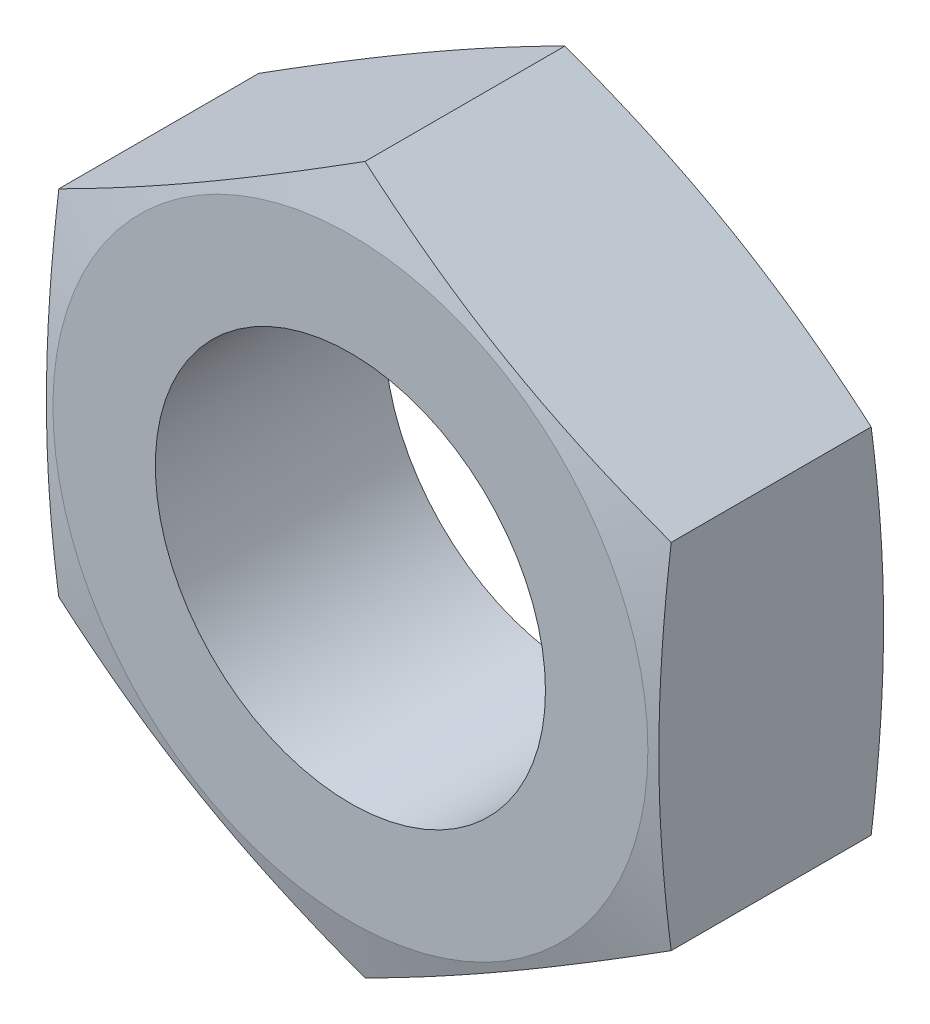
from build123d import *

# Parameters (mm, degrees)
SKETCH_3_OUTSIDE_W  = 20.708
SKETCH_3_OUTSIDE_H  = 20.708
CUT_EXTRUDE_2_DEPTH = 4.7


with BuildPart() as part:
    # Эскиз2 → Повернуть1 (revolve)
    with BuildSketch(Plane(origin=(0, 0, 0), x_dir=(0, 0, -1), z_dir=(1, 0, 0)), mode=Mode.PRIVATE) as revolve_1_sk:
        Polygon((0, 4), (0, 6.1), (0.3, 7.25), (4.4, 7.25), (4.7, 6.1), (4.7, 4), align=None)
    revolve(revolve_1_sk.sketch.rotate(Axis((0, 0, 0), (0, 0, -1)), 90), axis=Axis((0, 0, 0), (0, 0, -1)))

    # Эскиз3 outside → Вытянуть2 (cut)
    with BuildSketch(Plane.XY):
        Rectangle(SKETCH_3_OUTSIDE_W, SKETCH_3_OUTSIDE_H)
        Polygon((0, 7.25), (-6.278684177, 3.625), (-6.278684177, -3.625), (0, -7.25), (6.278684177, -3.625), (6.278684177, 3.625), align=None, mode=Mode.SUBTRACT)
    extrude(amount=-CUT_EXTRUDE_2_DEPTH, mode=Mode.SUBTRACT)


solid = part.part
